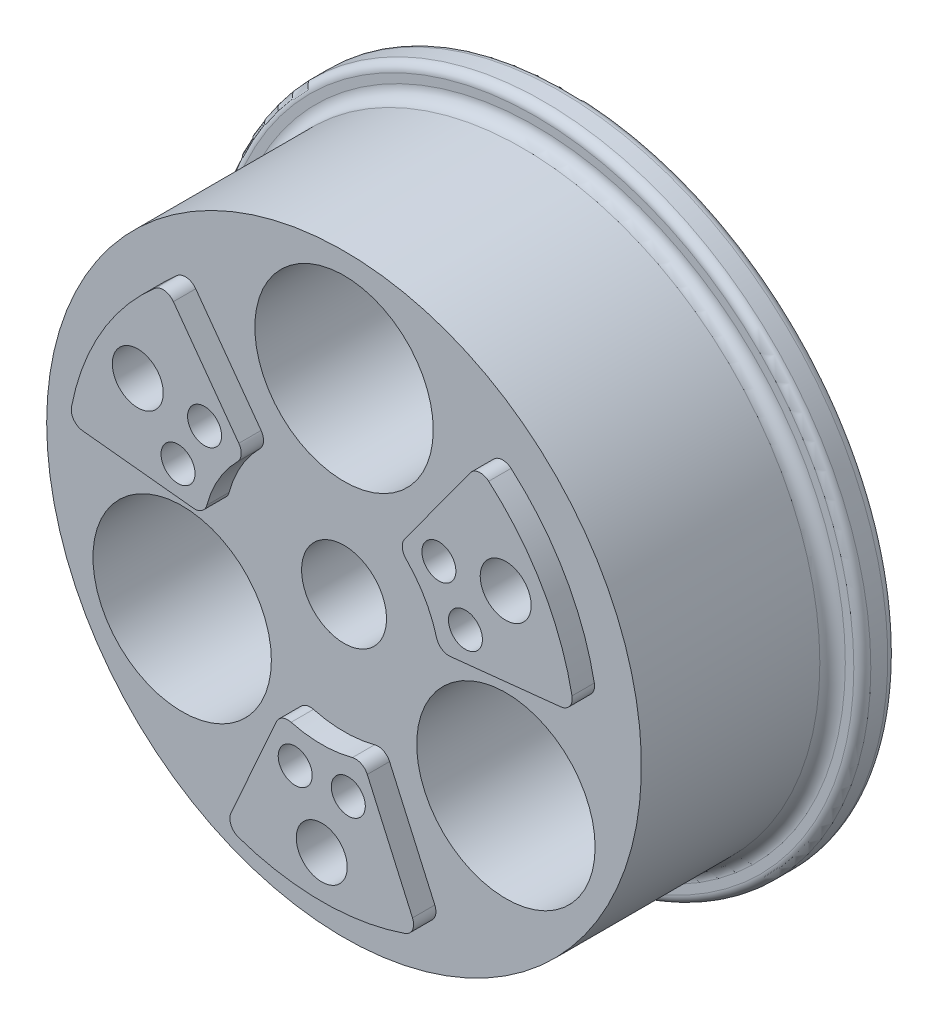
from build123d import *

# Parameters (mm, degrees)
ENL_V_MAT_EXTRU_1_DEPTH      = 122.107390361
ENL_V_MAT_EXTRU_1_DEPTH_BACK = 122.107390361
ESQUISSE2_R                  = 21
BOSS_EXTRU_1_DEPTH           = 5.25
TROUS_DE_CENTRAGE_8_0MM1_D   = 8
PER_AGE3_D                   = 12
PER_AGE3_CBORE_D             = 18
PER_AGE3_CBORE_DEPTH         = 46.25
CONG_1_R                     = 3
CONG_2_R                     = 2
CONG_3_R                     = 1
CONG_6_R                     = 3


with BuildPart() as part:
    # Esquisse1 → Révolution1 (revolve)
    with BuildSketch(Plane(origin=(0, 0, 0), x_dir=(0, 0, -1), z_dir=(1, 0, 0))):
        Polygon((0, 10), (0, 77), (-8, 77), (-8, 70), (-53, 70), (-53, 10), align=None)
    revolve(axis=Axis((0, 0, 0), (0, 0, 1)))

    # Esquisse2 → Enlèv. mat.-Extru.1 (cut, two sides: drawn at the far end of the back side and taken through both)
    with BuildSketch(Plane.XY.offset(53).offset(-ENL_V_MAT_EXTRU_1_DEPTH_BACK)):
        with Locations((0, 44)):
            Circle(ESQUISSE2_R)
        with Locations((38.105117767, -22)):
            Circle(ESQUISSE2_R)
        with Locations((-38.105117767, -22)):
            Circle(ESQUISSE2_R)
    extrude(amount=ENL_V_MAT_EXTRU_1_DEPTH + ENL_V_MAT_EXTRU_1_DEPTH_BACK, mode=Mode.SUBTRACT)

    # Esquisse2<3> → Boss.-Extru.1 (add)
    with BuildSketch(Plane.XY.offset(53)):
        with BuildLine():
            Line((36.783724687, 47.402084323), (17.954425256, 21.48577701))
            ThreePointArc((17.954425256, 21.48577701), (24.248711306, 14), (27.584441339, 4.806099877))
            Line((27.584441339, 4.806099877), (59.443271559, 8.154597863))
            ThreePointArc((59.443271559, 8.154597863), (51.961524227, 30), (36.783724687, 47.402084323))
        make_face()
        with BuildLine():
            Line((22.659546872, -55.556682186), (9.630016083, -26.291876887))
            ThreePointArc((9.630016083, -26.291876887), (0, -28), (-9.630016083, -26.291876887))
            Line((-9.630016083, -26.291876887), (-22.659546872, -55.556682186))
            ThreePointArc((-22.659546872, -55.556682186), (0, -60), (22.659546872, -55.556682186))
        make_face()
        with BuildLine():
            Line((-59.443271559, 8.154597863), (-27.584441339, 4.806099877))
            ThreePointArc((-27.584441339, 4.806099877), (-24.248711306, 14), (-17.954425256, 21.48577701))
            Line((-17.954425256, 21.48577701), (-36.783724687, 47.402084323))
            ThreePointArc((-36.783724687, 47.402084323), (-51.961524227, 30), (-59.443271559, 8.154597863))
        make_face()
    extrude(amount=BOSS_EXTRU_1_DEPTH)

    # Trous de centrage Ø8.0mm1 (through all)
    with Locations(Plane(origin=(27.577599952, 23.140353949, 0), x_dir=(-1, 0, 0), z_dir=(0, 0, -1))):
        with Locations((0, 0), (-6.251334396, -10.827628789), (21.326265556, -58.593433057), (33.828934348, -58.593433057), (61.4065343, -10.827628789), (55.155199904, 0)):
            Hole(TROUS_DE_CENTRAGE_8_0MM1_D / 2)

    # Perçage3 (through all)
    with Locations(Plane(origin=(43.301270189, 25, 0), x_dir=(-1, 0, 0), z_dir=(0, 0, -1))):
        with Locations((0, 0), (86.602540378, 0), (43.301270189, -75)):
            CounterBoreHole(PER_AGE3_D / 2, PER_AGE3_CBORE_D / 2, PER_AGE3_CBORE_DEPTH)

    # Congé1
    cong_1_edges = [part.edges().sort_by_distance(p)[0] for p in [
        (0, -70, 8),
    ]]
    fillet(cong_1_edges, radius=CONG_1_R)

    # Congé2
    cong_2_edges = [part.edges().sort_by_distance(p)[0] for p in [
        (0, -77, 8),
        (0, -77, 0),
    ]]
    fillet(cong_2_edges, radius=CONG_2_R)

    # Congé3
    cong_3_edges = [part.edges().sort_by_distance(p)[0] for p in [
        (2.251334396, -35.453079108, 0),
        (-34.301270189, 25, 0),
        (-31.577599952, 23.140353949, 0),
        (52.301270189, 25, 0),
        (23.577599952, 23.140353949, 0),
        (29.828934348, 12.31272516, 0),
        (17.105117767, -22, 0),
        (0, -10, 0),
        (-10.251334396, -35.453079108, 0),
        (9, -50, 0),
        (-59.105117767, -22, 0),
        (-37.828934348, 12.31272516, 0),
        (-21, 44, 0),
    ]]
    fillet(cong_3_edges, radius=CONG_3_R)

    # Congé6
    cong_6_edges = [part.edges().sort_by_distance(p)[0] for p in [
        (-9.630016083, -26.291876887, 55.625),
        (-22.659546872, -55.556682186, 55.625),
        (22.659546872, -55.556682186, 55.625),
        (9.630016083, -26.291876887, 55.625),
        (-36.783724687, 47.402084323, 55.625),
        (-59.443271559, 8.154597863, 55.625),
        (-17.954425256, 21.48577701, 55.625),
        (-27.584441339, 4.806099877, 55.625),
        (27.584441339, 4.806099877, 55.625),
        (17.954425256, 21.48577701, 55.625),
        (36.783724687, 47.402084323, 55.625),
        (59.443271559, 8.154597863, 55.625),
    ]]
    fillet(cong_6_edges, radius=CONG_6_R)


solid = part.part
